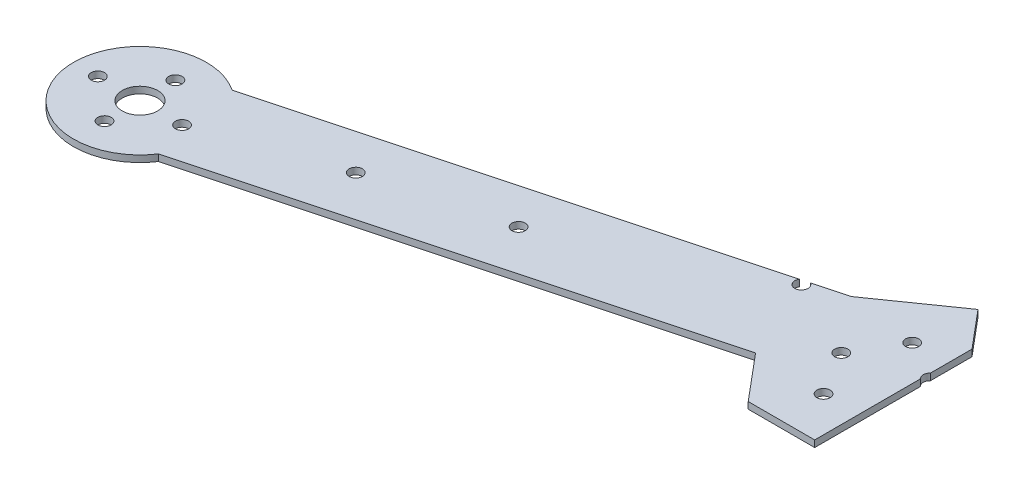
from build123d import *

# Parameters (mm, degrees)
SKETCH2_R           = 4
SKETCH2_R_2         = 1.5
BOSS_EXTRUDE1_DEPTH = 1.5
SKETCH6_R           = 1.5
CUT_EXTRUDE1_DEPTH  = 1.5
SKETCH7_R           = 1.5
CUT_EXTRUDE2_DEPTH  = 1.5


with BuildPart() as part:
    # Sketch2 → Boss-Extrude1 (new body)
    with BuildSketch(Plane(origin=(0, 0, 0), x_dir=(1, 0, 0), z_dir=(0, 1, 0))):
        with BuildLine():
            Line((0, -35.261127532), (0, -44.643093543))
            ThreePointArc((0, -44.643093543), (-0.5, -45.761127532), (0, -46.879161521))
            Line((0, -46.879161521), (0, -70.761127532))
            Line((0, -70.761127532), (-15, -70.761127532))
            Line((-15, -70.761127532), (-23.677632731, -60.41952755))
            Line((-23.677632731, -60.41952755), (-129.929473623, -88.889622511))
            ThreePointArc((-129.929473623, -88.889622511), (-157.136079306, -83.55030532), (-134.097880355, -68.124706791))
            Line((-134.097880355, -68.124706791), (-23.863280614, -38.592955603))
            Line((-23.863280614, -38.592955603), (-7.070663707, -26.834638658))
            Line((-7.070663707, -26.834638658), (0, -35.261127532))
        make_face()
        with Locations(Location((-142.429473623, -80.598060535, 0), (0, 0, 270))):
            Circle(SKETCH2_R, mode=Mode.SUBTRACT)
        with Locations(Location((-8, -60.761127532, 0), (0, 0, 270))):
            Circle(SKETCH2_R_2, mode=Mode.SUBTRACT)
        with Locations(Location((-14, -50.761127532, 0), (0, 0, 270))):
            Circle(SKETCH2_R_2, mode=Mode.SUBTRACT)
        with Locations(Location((-8, -40.761127532, 0), (0, 0, 270))):
            Circle(SKETCH2_R_2, mode=Mode.SUBTRACT)
        with Locations(Location((-142.429473623, -72.598060535, 0), (0, 0, 270))):
            Circle(SKETCH2_R_2, mode=Mode.SUBTRACT)
        with Locations(Location((-132.929473623, -80.598060535, 0), (0, 0, 270))):
            Circle(SKETCH2_R_2, mode=Mode.SUBTRACT)
        with Locations(Location((-151.929473623, -80.598060535, 0), (0, 0, 270))):
            Circle(SKETCH2_R_2, mode=Mode.SUBTRACT)
        with Locations(Location((-142.429473623, -88.598060535, 0), (0, 0, 270))):
            Circle(SKETCH2_R_2, mode=Mode.SUBTRACT)
    extrude(amount=BOSS_EXTRUDE1_DEPTH)

    # Sketch6 → Cut-Extrude1 (cut)
    with BuildSketch(Plane(origin=(0, 1.5, 0), x_dir=(1, 0, 0), z_dir=(0, 1, 0))):
        with Locations((-31.86, -41.901127532)):
            Circle(SKETCH6_R)
    extrude(amount=-CUT_EXTRUDE1_DEPTH, mode=Mode.SUBTRACT)

    # Sketch7 → Cut-Extrude2 (cut)
    with BuildSketch(Plane(origin=(0, 1.5, 0), x_dir=(1, 0, 0), z_dir=(0, 1, 0))):
        with Locations(Location((-104.014122572, -70.306622169, 0), (0, 0, 270))):
            Circle(SKETCH7_R)
        with Locations(Location((-75.035984993, -62.543404895, 0), (0, 0, 270))):
            Circle(SKETCH7_R)
    extrude(amount=-CUT_EXTRUDE2_DEPTH, mode=Mode.SUBTRACT)


solid = part.part
